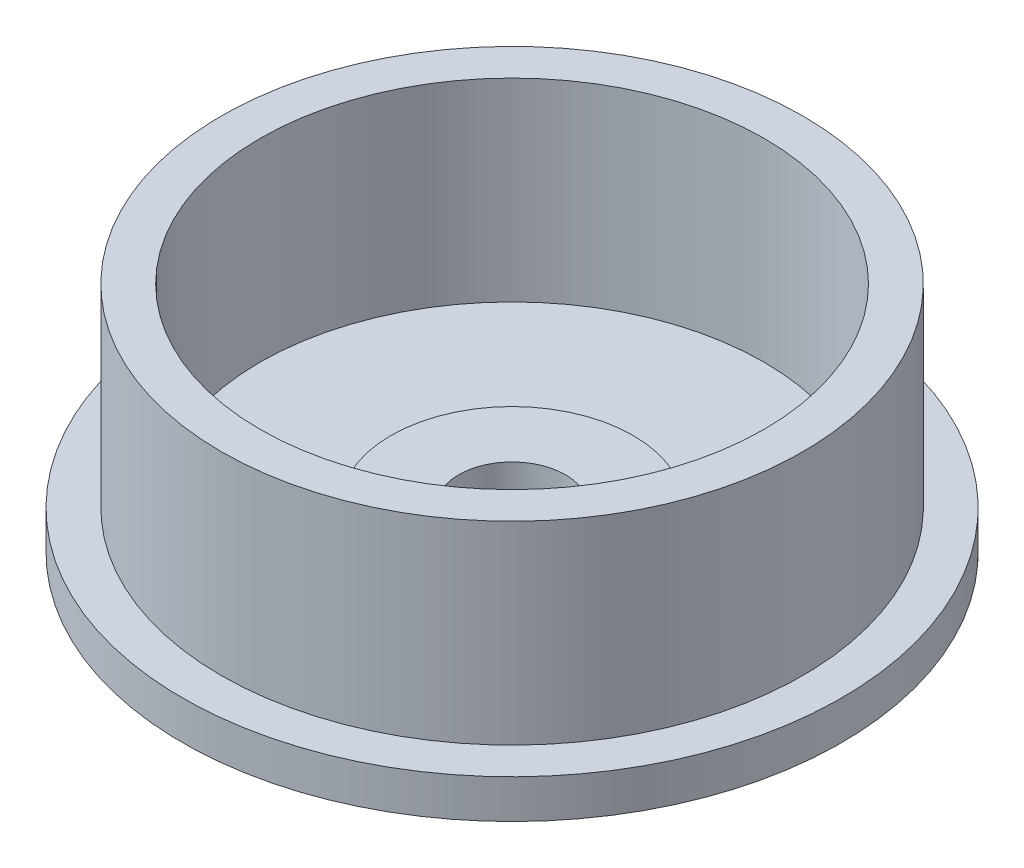
from build123d import *

# Parameters (mm, degrees)
SKETCH2_R           = 15
BOSS_EXTRUDE1_DEPTH = 12
SHELL1_T            = -2
SKETCH4_R           = 2.75
CUT_EXTRUDE1_DEPTH  = 25.372115214
SKETCH5_R           = 17
SKETCH5_R_2         = 15
BOSS_EXTRUDE3_DEPTH = 2
BOSS_EXTRUDE5_START = 4.4
SKETCH7_R           = 4.25
SKETCH7_R_2         = 2.75
BOSS_EXTRUDE5_DEPTH = 4.4
SKETCH6_R           = 6.25
SKETCH6_R_2         = 2.75
BOSS_EXTRUDE4_DEPTH = 0.1


with BuildPart() as part:
    # Sketch2 → Boss-Extrude1 (new body)
    with BuildSketch(Plane(origin=(0, 0, 0), x_dir=(1, 0, 0), z_dir=(0, 1, 0))):
        with Locations(Location((0, 0, 0), (0, 0, 270))):
            Circle(SKETCH2_R)
    extrude(amount=BOSS_EXTRUDE1_DEPTH)

    # Shell1
    shell1_openings = [part.faces().sort_by_distance(p)[0] for p in [
        (0, 12, 0),
    ]]
    offset(amount=SHELL1_T, openings=shell1_openings, kind=Kind.INTERSECTION)

    # Sketch4 → Cut-Extrude1 (cut, through all)
    with BuildSketch(Plane.XZ):
        with Locations(Location((0, 0, 0), (0, 0, 270))):
            Circle(SKETCH4_R)
    extrude(amount=-CUT_EXTRUDE1_DEPTH, mode=Mode.SUBTRACT)

    # Sketch5 → Boss-Extrude3 (add)
    with BuildSketch(Plane.XZ):
        with Locations(Location((0, 0, 0), (0, 0, 270))):
            Circle(SKETCH5_R)
        with Locations(Location((0, 0, 0), (0, 0, 270))):
            Circle(SKETCH5_R_2, mode=Mode.SUBTRACT)
    extrude(amount=-BOSS_EXTRUDE3_DEPTH)

    # Sketch7 → Boss-Extrude5 (add)
    with BuildSketch(Plane.XZ.offset(BOSS_EXTRUDE5_START)):
        with Locations(Location((0, 0, 0), (0, 0, 90))):
            Circle(SKETCH7_R)
        with Locations(Location((0, 0, 0), (0, 0, 270))):
            Circle(SKETCH7_R_2, mode=Mode.SUBTRACT)
    extrude(amount=-BOSS_EXTRUDE5_DEPTH)

    # Sketch6 → Boss-Extrude4 (add)
    with BuildSketch(Plane(origin=(0, 2, 0), x_dir=(1, 0, 0), z_dir=(0, 1, 0))):
        with Locations(Location((0, 0, 0), (0, 0, 90))):
            Circle(SKETCH6_R)
        with Locations(Location((0, 0, 0), (0, 0, 90))):
            Circle(SKETCH6_R_2, mode=Mode.SUBTRACT)
    extrude(amount=BOSS_EXTRUDE4_DEPTH)


solid = part.part
